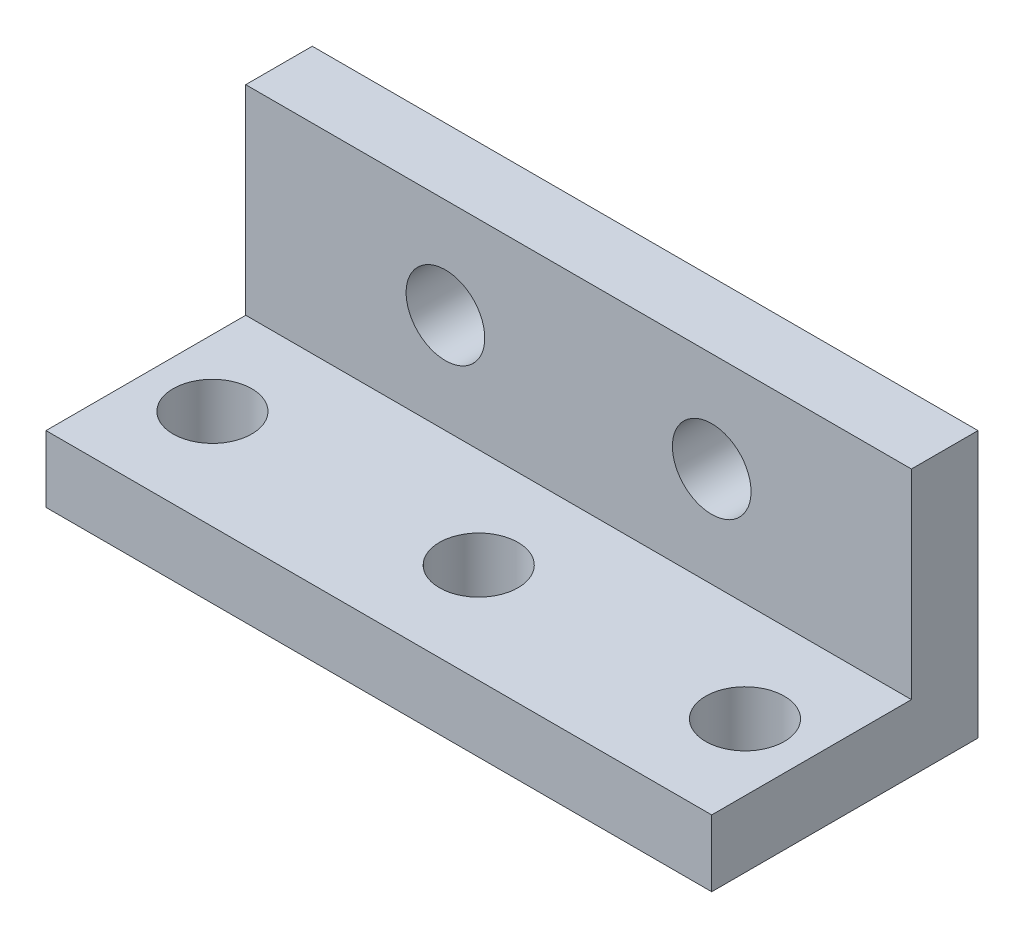
from build123d import *

# Parameters (mm, degrees)
SKETCH1_W           = 10.16
SKETCH1_H           = 10.16
BOSS_EXTRUDE1_DEPTH = 25.4
SKETCH2_W           = 7.62
SKETCH2_H           = 7.62
CUT_EXTRUDE1_DEPTH  = 30.182378244
SKETCH3_R           = 1.5
CUT_EXTRUDE2_DEPTH  = 29.398063314
SKETCH4_R           = 1.5
CUT_EXTRUDE3_DEPTH  = 29.398063314


with BuildPart() as part:
    # Sketch1 → Boss-Extrude1 (new body)
    with BuildSketch(Plane(origin=(0, 0, 0), x_dir=(0, 0, -1), z_dir=(1, 0, 0))):
        with Locations((5.08, 5.08)):
            Rectangle(SKETCH1_W, SKETCH1_H)
    extrude(amount=BOSS_EXTRUDE1_DEPTH)

    # Sketch2 → Cut-Extrude1 (cut, through all)
    with BuildSketch(Plane(origin=(25.4, 0, 0), x_dir=(0, 0, -1), z_dir=(1, 0, 0))):
        with Locations((3.81, 6.35)):
            Rectangle(SKETCH2_W, SKETCH2_H)
    extrude(amount=-CUT_EXTRUDE1_DEPTH, mode=Mode.SUBTRACT)

    # Sketch3 → Cut-Extrude2 (cut, through all)
    with BuildSketch(Plane.XY.offset(-7.62)):
        with Locations((7.62, 6.35)):
            Circle(SKETCH3_R)
        with Locations((17.78, 6.35)):
            Circle(SKETCH3_R)
    extrude(amount=-CUT_EXTRUDE2_DEPTH, mode=Mode.SUBTRACT)

    # Sketch4 → Cut-Extrude3 (cut, through all)
    with BuildSketch(Plane(origin=(0, 2.54, 0), x_dir=(1, 0, 0), z_dir=(0, 1, 0))):
        with Locations(Location((2.54, 3.81, 0), (0, 0, 270))):
            Circle(SKETCH4_R)
        with Locations(Location((22.86, 3.81, 0), (0, 0, 270))):
            Circle(SKETCH4_R)
        with Locations(Location((12.7, 3.81, 0), (0, 0, 270))):
            Circle(SKETCH4_R)
    extrude(amount=-CUT_EXTRUDE3_DEPTH, mode=Mode.SUBTRACT)


solid = part.part
